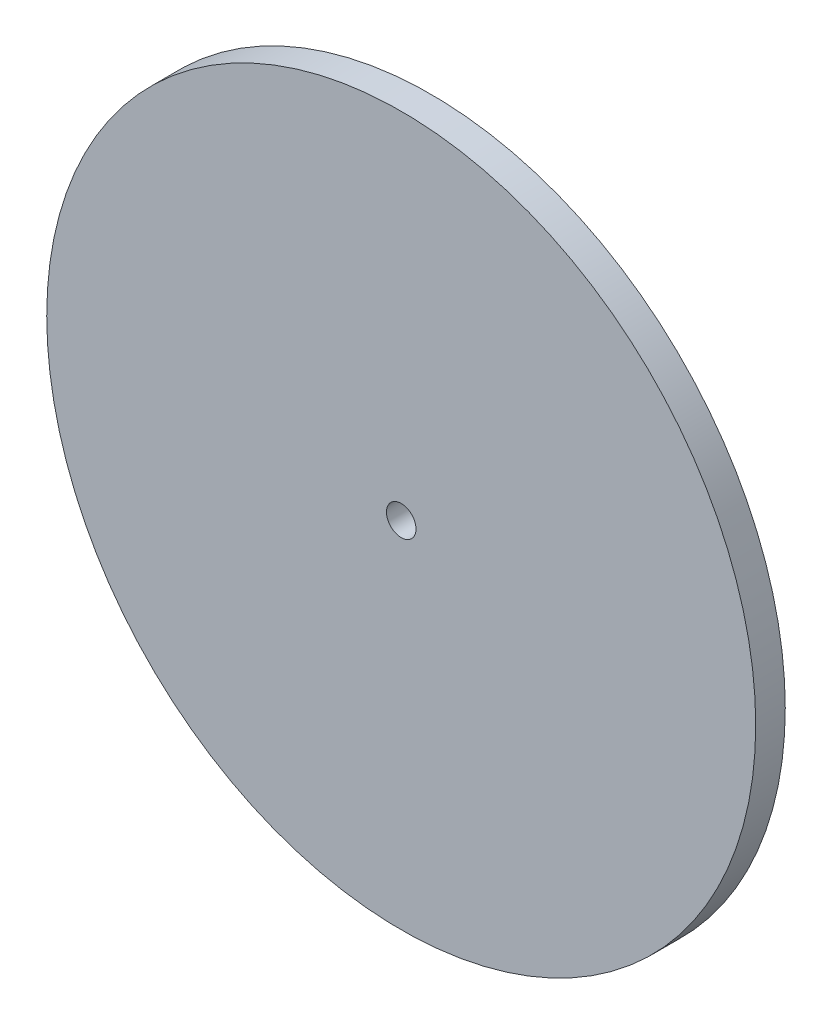
from build123d import *

# Parameters (mm, degrees)
SKETCH1_R           = 152.4
BOSS_EXTRUDE1_DEPTH = 12.7
SKETCH2_R           = 6.35
CUT_EXTRUDE1_DEPTH  = 216.9


with BuildPart() as part:
    # Sketch1 → Boss-Extrude1 (new body)
    with BuildSketch(Plane.XY):
        Circle(SKETCH1_R)
    extrude(amount=BOSS_EXTRUDE1_DEPTH)

    # Sketch2 → Cut-Extrude1 (cut, through all)
    with BuildSketch(Plane(origin=(0, 0, 0), x_dir=(-1, 0, 0), z_dir=(0, 0, -1))):
        Circle(SKETCH2_R)
    extrude(amount=-CUT_EXTRUDE1_DEPTH, mode=Mode.SUBTRACT)


solid = part.part
